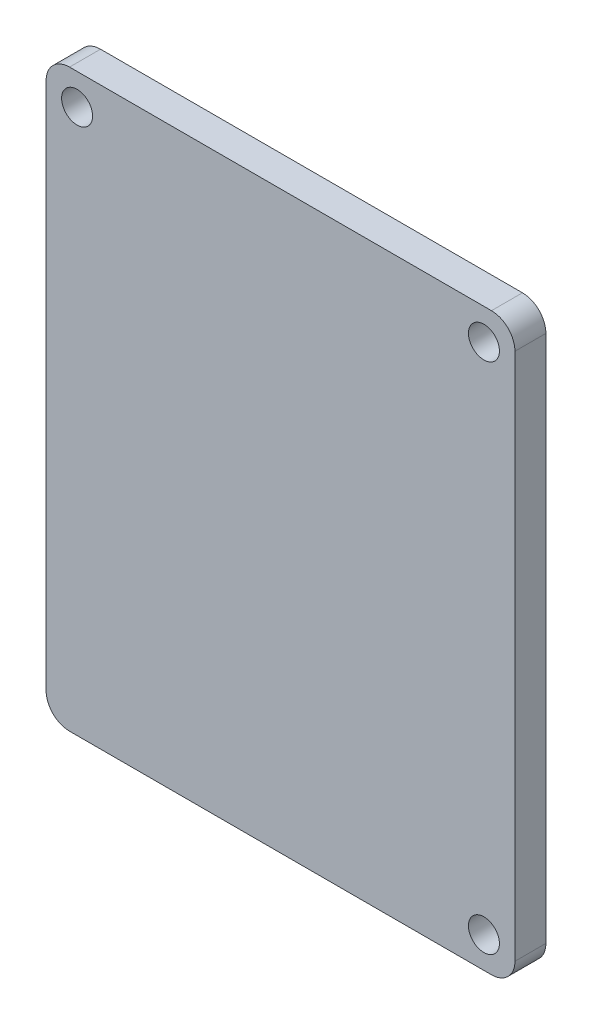
from build123d import *

# Parameters (mm, degrees)
ESBO_O1_R                = 1.5
RESSALTO_EXTRUS_O1_DEPTH = 3


with BuildPart() as part:
    # Esboço1 → Ressalto-extrusão1 (new body)
    with BuildSketch(Plane.XY):
        with BuildLine():
            Line((2.269692136, 0), (43.130307864, 0))
            ThreePointArc((43.130307864, 0), (44.735222564, 0.664777436), (45.4, 2.269692136))
            Line((45.4, 2.269692136), (45.4, 53.430307864))
            ThreePointArc((45.4, 53.430307864), (44.735222564, 55.035222564), (43.130307864, 55.7))
            Line((43.130307864, 55.7), (2.269692136, 55.7))
            ThreePointArc((2.269692136, 55.7), (0.664777436, 55.035222564), (0, 53.430307864))
            Line((0, 53.430307864), (0, 2.269692136))
            ThreePointArc((0, 2.269692136), (0.664777436, 0.664777436), (2.269692136, 0))
        make_face()
        with Locations((42.4, 3)):
            Circle(ESBO_O1_R, mode=Mode.SUBTRACT)
        with Locations((42.4, 52.7)):
            Circle(ESBO_O1_R, mode=Mode.SUBTRACT)
        with Locations((3, 52.7)):
            Circle(ESBO_O1_R, mode=Mode.SUBTRACT)
    extrude(amount=RESSALTO_EXTRUS_O1_DEPTH)


solid = part.part
